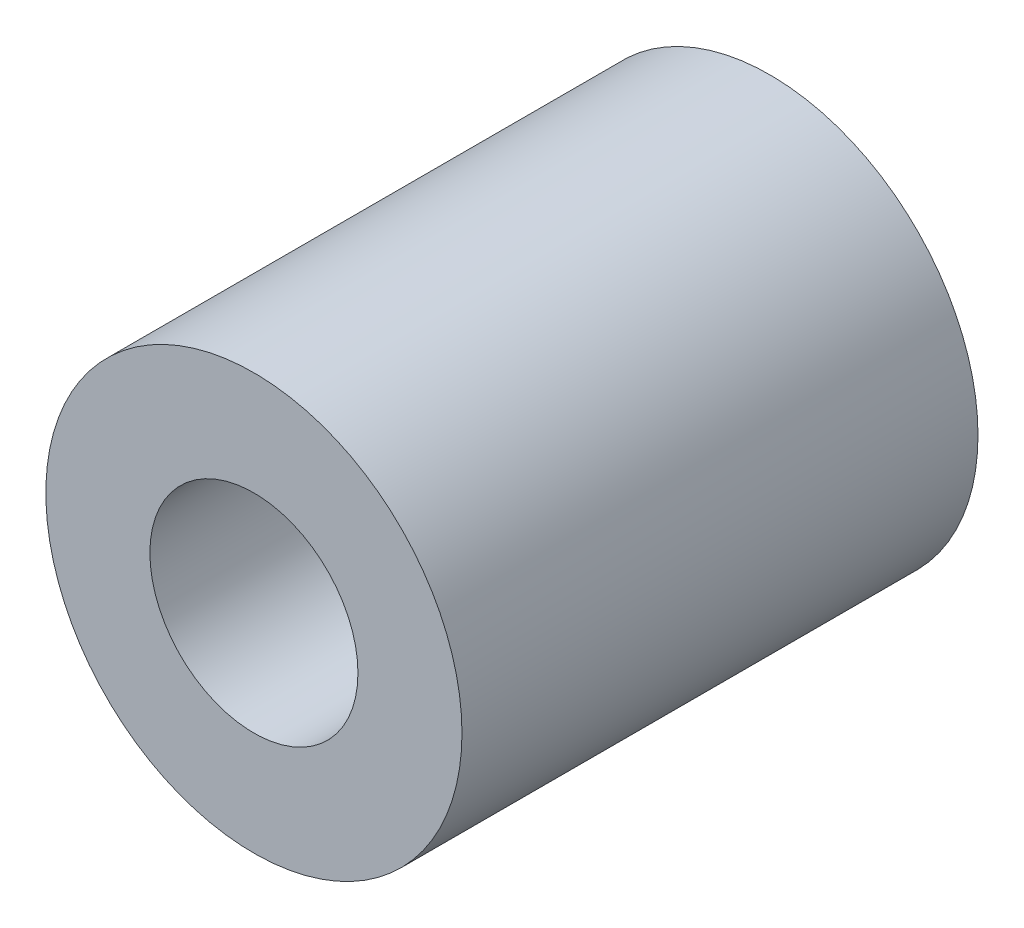
from build123d import *

# Parameters (mm, degrees)
SKETCH1_R           = 6.35
SKETCH1_R_2         = 3.175
BOSS_EXTRUDE1_DEPTH = 7.874


with BuildPart() as part:
    # Sketch1 → Boss-Extrude1 (new, symmetric)
    with BuildSketch(Plane.XY):
        Circle(SKETCH1_R)
        Circle(SKETCH1_R_2, mode=Mode.SUBTRACT)
    extrude(amount=BOSS_EXTRUDE1_DEPTH, both=True)


solid = part.part
